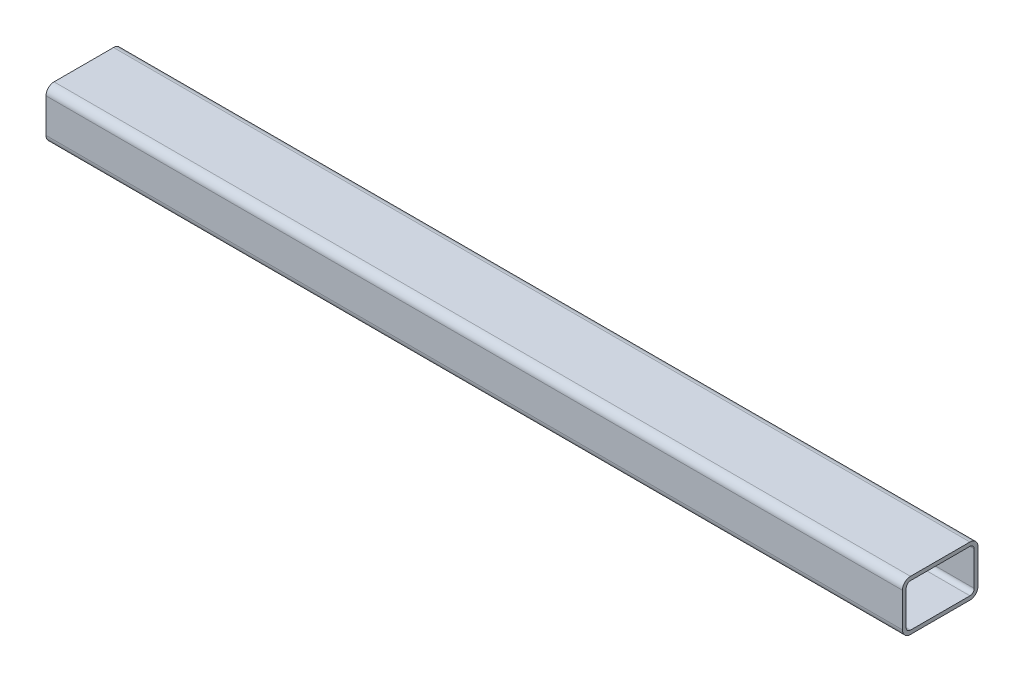
from build123d import *

# Parameters (mm, degrees)
RECTANGULAR_TUBE_CONFIGURED_60_X_40_X_DEPTH = 680


with BuildPart() as part:
    # Sketch1 → Rectangular tube - configured 60 X 40 X 3.2(2) (new body)
    with BuildSketch(Plane.YZ.offset(-340)):
        with BuildLine():
            Line((-13.6, -30), (13.6, -30))
            ThreePointArc((13.6, -30), (18.1254834, -28.1254834), (20, -23.6))
            Line((20, -23.6), (20, 23.6))
            ThreePointArc((20, 23.6), (18.1254834, 28.1254834), (13.6, 30))
            Line((13.6, 30), (-13.6, 30))
            ThreePointArc((-13.6, 30), (-18.1254834, 28.1254834), (-20, 23.6))
            Line((-20, 23.6), (-20, -23.6))
            ThreePointArc((-20, -23.6), (-18.1254834, -28.1254834), (-13.6, -30))
        make_face()
        with BuildLine():
            Line((-13.6, -27), (13.6, -27))
            ThreePointArc((13.6, -27), (16.004163056, -26.004163056), (17, -23.6))
            Line((17, -23.6), (17, 23.6))
            ThreePointArc((17, 23.6), (16.004163056, 26.004163056), (13.6, 27))
            Line((13.6, 27), (-13.6, 27))
            ThreePointArc((-13.6, 27), (-16.004163056, 26.004163056), (-17, 23.6))
            Line((-17, 23.6), (-17, -23.6))
            ThreePointArc((-17, -23.6), (-16.004163056, -26.004163056), (-13.6, -27))
        make_face(mode=Mode.SUBTRACT)
    extrude(amount=RECTANGULAR_TUBE_CONFIGURED_60_X_40_X_DEPTH)


solid = part.part
